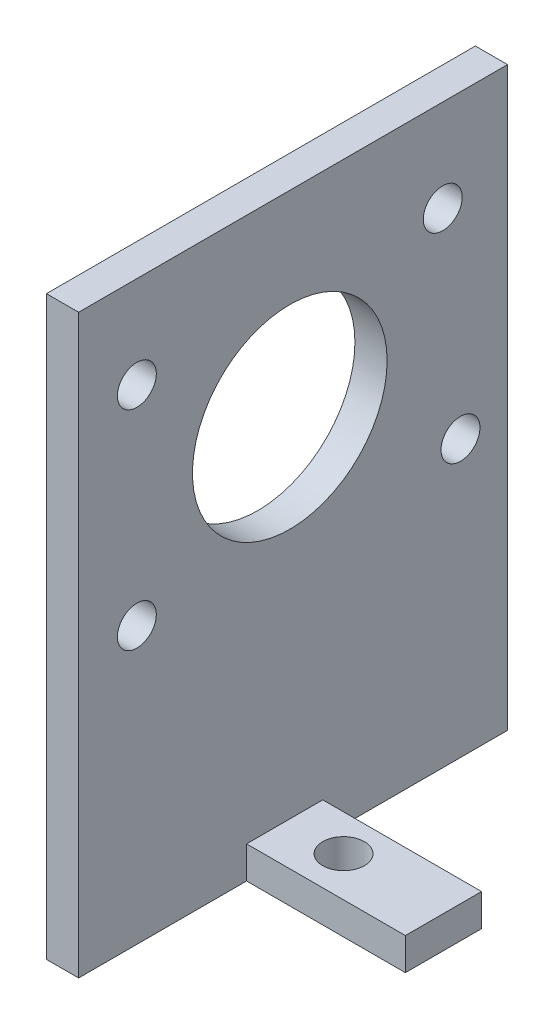
from build123d import *

# Parameters (mm, degrees)
EXTRUDE_THIN2_DEPTH = 30.852042279
SKETCH2_R           = 1.5
CUT_EXTRUDE1_DEPTH  = 53.491563016
SKETCH4_R           = 7
CUT_EXTRUDE3_DEPTH  = 53.491563016
SKETCH6_R           = 1.4
CUT_EXTRUDE5_DEPTH  = 53.491563016
SKETCH7_W           = 16.44057734
SKETCH7_H           = 12.081190297
SKETCH7_H_2         = 13.290689101
CUT_EXTRUDE6_DEPTH  = 53.491563016
SKETCH8_W           = 5.019650722
SKETCH8_H           = 5.480162881
CUT_EXTRUDE7_DEPTH  = 53.491563016


with BuildPart() as part:
    # Sketch1 → Extrude-Thin2 (new body)
    with BuildSketch(Plane.XY):
        Polygon((16.44057734, 0), (0, 0), (0, 39.156392732), (-2.315200758, 39.156392732), (-2.315200758, -2.315200758), (16.44057734, -2.315200758), align=None)
    extrude(amount=-EXTRUDE_THIN2_DEPTH)

    # Sketch2 → Cut-Extrude1 (cut, through all)
    with BuildSketch(Plane(origin=(0, 0, 0), x_dir=(1, 0, 0), z_dir=(0, 1, 0))):
        with Locations(Location((4.097708223, 14.957133601, 0), (0, 0, 270))):
            Circle(SKETCH2_R)
    extrude(amount=-CUT_EXTRUDE1_DEPTH, mode=Mode.SUBTRACT)

    # Sketch4 → Cut-Extrude3 (cut, through all)
    with BuildSketch(Plane(origin=(0, 0, 0), x_dir=(0, 0, -1), z_dir=(1, 0, 0))):
        with Locations((15.188954452, 25.039458811)):
            Circle(SKETCH4_R)
    extrude(amount=-CUT_EXTRUDE3_DEPTH, mode=Mode.SUBTRACT)

    # Sketch6 → Cut-Extrude5 (cut, through all)
    with BuildSketch(Plane(origin=(0, 0, 0), x_dir=(0, 0, -1), z_dir=(1, 0, 0))):
        with Locations((4.188954452, 32.539458811)):
            Circle(SKETCH6_R)
        with Locations((4.188954452, 17.539458811)):
            Circle(SKETCH6_R)
        with Locations((26.188954452, 32.539458811)):
            Circle(SKETCH6_R)
        with Locations((27.46487917, 17.539458811)):
            Circle(SKETCH6_R)
    extrude(amount=-CUT_EXTRUDE5_DEPTH, mode=Mode.SUBTRACT)

    # Sketch7 → Cut-Extrude6 (cut, through all)
    with BuildSketch(Plane(origin=(0, 0, 0), x_dir=(1, 0, 0), z_dir=(0, 1, 0))):
        with Locations((8.22028867, 6.040595149)):
            Rectangle(SKETCH7_W, SKETCH7_H)
        with Locations((8.22028867, 24.206697729)):
            Rectangle(SKETCH7_W, SKETCH7_H_2)
    extrude(amount=-CUT_EXTRUDE6_DEPTH, mode=Mode.SUBTRACT)

    # Sketch8 → Cut-Extrude7 (cut, through all)
    with BuildSketch(Plane(origin=(0, 0, 0), x_dir=(1, 0, 0), z_dir=(0, 1, 0))):
        with Locations((13.930751979, 14.821271738)):
            Rectangle(SKETCH8_W, SKETCH8_H)
    extrude(amount=-CUT_EXTRUDE7_DEPTH, mode=Mode.SUBTRACT)


solid = part.part
